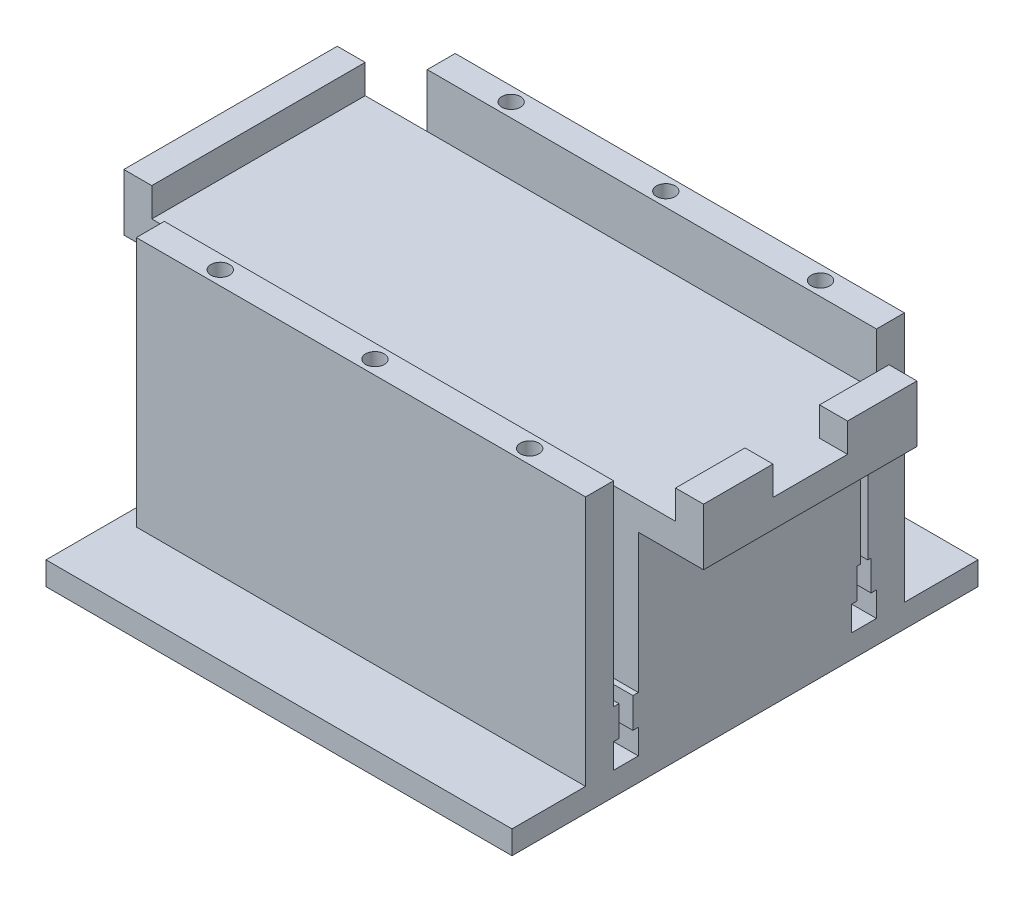
from build123d import *

# Parameters (mm, degrees)
SKETCH1_W            = 46.4
SKETCH1_H            = 24.75
BOSS_EXTRUDE1_DEPTH  = 5.9
BOSS_EXTRUDE2_DEPTH  = 2.5
SKETCH3_W            = 50
SKETCH3_H            = 50
BOSS_EXTRUDE3_DEPTH  = 2.5
SKETCH4_W            = 46.4
SKETCH4_H            = 0.93
BOSS_EXTRUDE4_DEPTH  = 5.9
SKETCH5_W            = 46.4
SKETCH5_H            = 0.93
BOSS_EXTRUDE5_DEPTH  = 5.9
SKETCH6_W            = 46.4
SKETCH6_H            = 3
BOSS_EXTRUDE6_DEPTH  = 8.4
SKETCH7_W            = 46.4
SKETCH7_H            = 3
BOSS_EXTRUDE7_DEPTH  = 8.4
SKETCH8_W            = 46.4
SKETCH8_H            = 22.9
BOSS_EXTRUDE8_DEPTH  = 8.4
SKETCH9_W            = 46.4
SKETCH9_H            = 3
BOSS_EXTRUDE9_DEPTH  = 8.4
SKETCH10_W           = 22.9
SKETCH10_H           = 10.9
BOSS_EXTRUDE10_DEPTH = 1.8
SKETCH11_W           = 0.93
SKETCH11_H           = 5.9
BOSS_EXTRUDE11_DEPTH = 1.8
SKETCH12_W           = 32.7
SKETCH12_H           = 0.925
SKETCH12_H_2         = 0.93
BOSS_EXTRUDE12_DEPTH = 8.4
SKETCH13_W           = 0.93
SKETCH13_H           = 5.9
BOSS_EXTRUDE13_DEPTH = 1.8
SKETCH14_W           = 48.2
SKETCH14_H           = 3
BOSS_EXTRUDE14_DEPTH = 8.4
SKETCH15_W           = 32.7
SKETCH15_H           = 0.93
SKETCH15_H_2         = 0.925
BOSS_EXTRUDE15_DEPTH = 8.4
SKETCH16_W           = 0.35
SKETCH16_H           = 5.9
CUT_EXTRUDE1_DEPTH   = 59.371568422
SKETCH18_W           = 0.35
SKETCH18_H           = 5.9
CUT_EXTRUDE2_DEPTH   = 59.371568422
SKETCH20_W           = 22.9
SKETCH20_H           = 2.5
BOSS_EXTRUDE17_DEPTH = 4
SKETCH22_W           = 22.9
SKETCH22_H           = 2.5
BOSS_EXTRUDE19_DEPTH = 3
SKETCH23_W           = 3
SKETCH23_H           = 22.9
BOSS_EXTRUDE20_DEPTH = 1.5
SKETCH24_W           = 22.9
SKETCH24_H           = 2.5
BOSS_EXTRUDE21_DEPTH = 7
SKETCH25_W           = 3
SKETCH25_H           = 22.9
BOSS_EXTRUDE22_DEPTH = 3
SKETCH27_W           = 48.2
SKETCH27_H           = 3
BOSS_EXTRUDE23_DEPTH = 7
SKETCH28_W           = 56.2
SKETCH28_H           = 22.9
BOSS_EXTRUDE24_DEPTH = 7
SKETCH29_W           = 3
SKETCH29_H           = 22.9
BOSS_EXTRUDE25_DEPTH = 7
SKETCH30_W           = 3
SKETCH30_H           = 22.9
BOSS_EXTRUDE26_DEPTH = 7
SKETCH31_W           = 7
SKETCH31_H           = 6.5
CUT_EXTRUDE3_DEPTH   = 56.415182938
SKETCH32_W           = 7
SKETCH32_H           = 6.5
CUT_EXTRUDE4_DEPTH   = 56.415182938
SKETCH33_W           = 2.66
SKETCH33_H           = 2.66
CUT_EXTRUDE5_DEPTH   = 67.259188042
SKETCH34_W           = 2.66
SKETCH34_H           = 2.66
CUT_EXTRUDE6_DEPTH   = 67.259188042
SKETCH35_W           = 3
SKETCH35_H           = 8
CUT_EXTRUDE7_DEPTH   = 3
SKETCH36_W           = 3
SKETCH36_H           = 22.9
BOSS_EXTRUDE27_DEPTH = 1.5
SKETCH38_W           = 48.2
SKETCH38_H           = 3
BOSS_EXTRUDE28_DEPTH = 3.1
SKETCH39_W           = 48.2
SKETCH39_H           = 3
BOSS_EXTRUDE29_DEPTH = 3.1
SKETCH40_W           = 3
SKETCH40_H           = 7.45
BOSS_EXTRUDE30_DEPTH = 0.1
SKETCH41_W           = 3
SKETCH41_H           = 22.9
BOSS_EXTRUDE31_DEPTH = 0.1
SKETCH42_R           = 1
CUT_EXTRUDE8_DEPTH   = 10


with BuildPart() as part:
    # Sketch1 → Boss-Extrude1 (new body)
    with BuildSketch(Plane(origin=(0, 0, 0), x_dir=(1, 0, 0), z_dir=(0, 1, 0))):
        Rectangle(SKETCH1_W, SKETCH1_H)
    extrude(amount=BOSS_EXTRUDE1_DEPTH)

    # Sketch2 → Boss-Extrude2 (add)
    with BuildSketch(Plane(origin=(0, 5.9, 0), x_dir=(1, 0, 0), z_dir=(0, 1, 0))):
        Polygon((23.2, -11.45), (23.2, 0), (23.2, 11.45), (-23.2, 11.45), (-23.2, -11.45), align=None)
    extrude(amount=BOSS_EXTRUDE2_DEPTH)

    # Sketch3 → Boss-Extrude3 (add)
    with BuildSketch(Plane.XZ):
        Rectangle(SKETCH3_W, SKETCH3_H)
    extrude(amount=BOSS_EXTRUDE3_DEPTH)

    # Sketch4 → Boss-Extrude4 (add)
    with BuildSketch(Plane(origin=(0, 0, 0), x_dir=(1, 0, 0), z_dir=(0, 1, 0))):
        with Locations((0, 13.64)):
            Rectangle(SKETCH4_W, SKETCH4_H)
    extrude(amount=BOSS_EXTRUDE4_DEPTH)

    # Sketch5 → Boss-Extrude5 (add)
    with BuildSketch(Plane(origin=(0, 0, 0), x_dir=(1, 0, 0), z_dir=(0, 1, 0))):
        with Locations((0, -13.64)):
            Rectangle(SKETCH5_W, SKETCH5_H)
    extrude(amount=BOSS_EXTRUDE5_DEPTH)

    # Sketch6 → Boss-Extrude6 (add)
    with BuildSketch(Plane(origin=(0, 0, 0), x_dir=(1, 0, 0), z_dir=(0, 1, 0))):
        with Locations((0, 15.605)):
            Rectangle(SKETCH6_W, SKETCH6_H)
    extrude(amount=BOSS_EXTRUDE6_DEPTH)

    # Sketch7 → Boss-Extrude7 (add)
    with BuildSketch(Plane(origin=(0, 0, 0), x_dir=(1, 0, 0), z_dir=(0, 1, 0))):
        with Locations((0, -15.605)):
            Rectangle(SKETCH7_W, SKETCH7_H)
    extrude(amount=BOSS_EXTRUDE7_DEPTH)

    # Sketch8 → Boss-Extrude8 (add)
    with BuildSketch(Plane(origin=(0, 8.4, 0), x_dir=(1, 0, 0), z_dir=(0, 1, 0))):
        Rectangle(SKETCH8_W, SKETCH8_H)
    extrude(amount=BOSS_EXTRUDE8_DEPTH)

    # Sketch9 → Boss-Extrude9 (add)
    with BuildSketch(Plane(origin=(0, 8.4, 0), x_dir=(1, 0, 0), z_dir=(0, 1, 0))):
        with Locations((0, -15.605)):
            Rectangle(SKETCH9_W, SKETCH9_H)
    extrude(amount=BOSS_EXTRUDE9_DEPTH)

    # Sketch10 → Boss-Extrude10 (add)
    with BuildSketch(Plane(origin=(23.2, 0, 0), x_dir=(0, 0, -1), z_dir=(1, 0, 0))):
        with Locations((0, 11.35)):
            Rectangle(SKETCH10_W, SKETCH10_H)
        Polygon((-11.45, 5.9), (11.45, 5.9), (12.375, 5.9), (12.375, 0), (-12.375, 0), (-12.375, 5.9), align=None)
    extrude(amount=BOSS_EXTRUDE10_DEPTH)

    # Sketch11 → Boss-Extrude11 (add)
    with BuildSketch(Plane(origin=(23.2, 0, 0), x_dir=(0, 0, -1), z_dir=(1, 0, 0))):
        Polygon((-14.105, 16.8), (-17.105, 16.8), (-17.105, 0), (-14.105, 0), (-14.105, 5.9), align=None)
        with Locations((-13.64, 2.95)):
            Rectangle(SKETCH11_W, SKETCH11_H)
    extrude(amount=BOSS_EXTRUDE11_DEPTH)

    # Sketch12 → Boss-Extrude12 (add)
    with BuildSketch(Plane(origin=(0, 5.9, 0), x_dir=(1, 0, 0), z_dir=(0, 1, 0))):
        with Locations((-6.85, -11.9125)):
            Rectangle(SKETCH12_W, SKETCH12_H)
        with Locations((-6.85, -13.64)):
            Rectangle(SKETCH12_W, SKETCH12_H_2)
    extrude(amount=BOSS_EXTRUDE12_DEPTH)

    # Sketch13 → Boss-Extrude13 (add)
    with BuildSketch(Plane(origin=(23.2, 0, 0), x_dir=(0, 0, -1), z_dir=(1, 0, 0))):
        Polygon((17.105, 0), (17.105, 8.4), (14.105, 8.4), (14.105, 5.9), (14.105, 0), align=None)
        with Locations((13.64, 2.95)):
            Rectangle(SKETCH13_W, SKETCH13_H)
    extrude(amount=BOSS_EXTRUDE13_DEPTH)

    # Sketch14 → Boss-Extrude14 (add)
    with BuildSketch(Plane(origin=(0, 8.4, 0), x_dir=(1, 0, 0), z_dir=(0, 1, 0))):
        with Locations((0.9, 15.605)):
            Rectangle(SKETCH14_W, SKETCH14_H)
    extrude(amount=BOSS_EXTRUDE14_DEPTH)

    # Sketch15 → Boss-Extrude15 (add)
    with BuildSketch(Plane(origin=(0, 5.9, 0), x_dir=(1, 0, 0), z_dir=(0, 1, 0))):
        with Locations((8.65, 13.64)):
            Rectangle(SKETCH15_W, SKETCH15_H)
        with Locations((8.65, 11.9125)):
            Rectangle(SKETCH15_W, SKETCH15_H_2)
    extrude(amount=BOSS_EXTRUDE15_DEPTH)

    # Sketch16 → Cut-Extrude1 (cut, through all)
    with BuildSketch(Plane(origin=(25, 0, 0), x_dir=(0, 0, -1), z_dir=(1, 0, 0))):
        with Locations((-12.2, 2.95)):
            Rectangle(SKETCH16_W, SKETCH16_H)
        with Locations((-13.35, 2.95)):
            Rectangle(SKETCH16_W, SKETCH16_H)
    extrude(amount=-CUT_EXTRUDE1_DEPTH, mode=Mode.SUBTRACT)

    # Sketch18 → Cut-Extrude2 (cut, through all)
    with BuildSketch(Plane(origin=(25, 0, 0), x_dir=(0, 0, -1), z_dir=(1, 0, 0))):
        with Locations((12.2, 2.95)):
            Rectangle(SKETCH18_W, SKETCH18_H)
        with Locations((13.35, 2.95)):
            Rectangle(SKETCH18_W, SKETCH18_H)
    extrude(amount=-CUT_EXTRUDE2_DEPTH, mode=Mode.SUBTRACT)

    # Sketch20 → Boss-Extrude17 (add)
    with BuildSketch(Plane.ZY.offset(23.2)):
        with Locations((0, 15.55)):
            Rectangle(SKETCH20_W, SKETCH20_H)
    extrude(amount=BOSS_EXTRUDE17_DEPTH)

    # Sketch22 → Boss-Extrude19 (add)
    with BuildSketch(Plane.ZY.offset(27.2)):
        with Locations((0, 15.55)):
            Rectangle(SKETCH22_W, SKETCH22_H)
    extrude(amount=BOSS_EXTRUDE19_DEPTH)

    # Sketch23 → Boss-Extrude20 (add)
    with BuildSketch(Plane(origin=(0, 16.8, 0), x_dir=(1, 0, 0), z_dir=(0, 1, 0))):
        with Locations((-28.7, 0)):
            Rectangle(SKETCH23_W, SKETCH23_H)
    extrude(amount=BOSS_EXTRUDE20_DEPTH)

    # Sketch24 → Boss-Extrude21 (add)
    with BuildSketch(Plane(origin=(25, 0, 0), x_dir=(0, 0, -1), z_dir=(1, 0, 0))):
        with Locations((0, 15.55)):
            Rectangle(SKETCH24_W, SKETCH24_H)
    extrude(amount=BOSS_EXTRUDE21_DEPTH)

    # Sketch25 → Boss-Extrude22 (add)
    with BuildSketch(Plane(origin=(0, 16.8, 0), x_dir=(1, 0, 0), z_dir=(0, 1, 0))):
        with Locations((30.5, 0)):
            Rectangle(SKETCH25_W, SKETCH25_H)
    extrude(amount=BOSS_EXTRUDE22_DEPTH)

    # Sketch27 → Boss-Extrude23 (add)
    with BuildSketch(Plane(origin=(0, 16.8, 0), x_dir=(1, 0, 0), z_dir=(0, 1, 0))):
        with Locations((0.9, 15.605)):
            Rectangle(SKETCH27_W, SKETCH27_H)
        with Locations((0.9, -15.605)):
            Rectangle(SKETCH27_W, SKETCH27_H)
    extrude(amount=BOSS_EXTRUDE23_DEPTH)

    # Sketch28 → Boss-Extrude24 (add)
    with BuildSketch(Plane(origin=(0, 16.8, 0), x_dir=(1, 0, 0), z_dir=(0, 1, 0))):
        with Locations((0.9, 0)):
            Rectangle(SKETCH28_W, SKETCH28_H)
    extrude(amount=BOSS_EXTRUDE24_DEPTH)

    # Sketch29 → Boss-Extrude25 (add)
    with BuildSketch(Plane(origin=(0, 18.3, 0), x_dir=(1, 0, 0), z_dir=(0, 1, 0))):
        with Locations((-28.7, 0)):
            Rectangle(SKETCH29_W, SKETCH29_H)
    extrude(amount=BOSS_EXTRUDE25_DEPTH)

    # Sketch30 → Boss-Extrude26 (add)
    with BuildSketch(Plane(origin=(0, 19.8, 0), x_dir=(1, 0, 0), z_dir=(0, 1, 0))):
        with Locations((30.5, 0)):
            Rectangle(SKETCH30_W, SKETCH30_H)
    extrude(amount=BOSS_EXTRUDE26_DEPTH)

    # Sketch31 → Cut-Extrude3 (cut, through all)
    with BuildSketch(Plane(origin=(0, 0, -11.45), x_dir=(-1, 0, 0), z_dir=(0, 0, -1))):
        with Locations((26.7, 17.55)):
            Rectangle(SKETCH31_W, SKETCH31_H)
    extrude(amount=-CUT_EXTRUDE3_DEPTH, mode=Mode.SUBTRACT)

    # Sketch32 → Cut-Extrude4 (cut, through all)
    with BuildSketch(Plane.XY.offset(11.45)):
        with Locations((28.5, 17.55)):
            Rectangle(SKETCH32_W, SKETCH32_H)
    extrude(amount=-CUT_EXTRUDE4_DEPTH, mode=Mode.SUBTRACT)

    # Sketch33 → Cut-Extrude5 (cut, through all)
    with BuildSketch(Plane.ZY.offset(23.2)):
        with Locations((-12.775, 1.33)):
            Rectangle(SKETCH33_W, SKETCH33_H)
    extrude(amount=-CUT_EXTRUDE5_DEPTH, mode=Mode.SUBTRACT)

    # Sketch34 → Cut-Extrude6 (cut, through all)
    with BuildSketch(Plane.ZY.offset(23.2)):
        with Locations((12.775, 1.33)):
            Rectangle(SKETCH34_W, SKETCH34_H)
    extrude(amount=-CUT_EXTRUDE6_DEPTH, mode=Mode.SUBTRACT)

    # Sketch35 → Cut-Extrude7 (cut)
    with BuildSketch(Plane(origin=(0, 26.8, 0), x_dir=(1, 0, 0), z_dir=(0, 1, 0))):
        with Locations((30.5, 0)):
            Rectangle(SKETCH35_W, SKETCH35_H)
    extrude(amount=-CUT_EXTRUDE7_DEPTH, mode=Mode.SUBTRACT)

    # Sketch36 → Boss-Extrude27 (add)
    with BuildSketch(Plane(origin=(0, 25.3, 0), x_dir=(1, 0, 0), z_dir=(0, 1, 0))):
        with Locations((-28.7, 0)):
            Rectangle(SKETCH36_W, SKETCH36_H)
    extrude(amount=BOSS_EXTRUDE27_DEPTH)

    # Sketch38 → Boss-Extrude28 (add)
    with BuildSketch(Plane(origin=(0, 23.8, 0), x_dir=(1, 0, 0), z_dir=(0, 1, 0))):
        with Locations((0.9, -15.605)):
            Rectangle(SKETCH38_W, SKETCH38_H)
    extrude(amount=BOSS_EXTRUDE28_DEPTH)

    # Sketch39 → Boss-Extrude29 (add)
    with BuildSketch(Plane(origin=(0, 23.8, 0), x_dir=(1, 0, 0), z_dir=(0, 1, 0))):
        with Locations((0.9, 15.605)):
            Rectangle(SKETCH39_W, SKETCH39_H)
    extrude(amount=BOSS_EXTRUDE29_DEPTH)

    # Sketch40 → Boss-Extrude30 (add)
    with BuildSketch(Plane(origin=(0, 26.8, 0), x_dir=(1, 0, 0), z_dir=(0, 1, 0))):
        with Locations((30.5, 7.725)):
            Rectangle(SKETCH40_W, SKETCH40_H)
        with Locations((30.5, -7.725)):
            Rectangle(SKETCH40_W, SKETCH40_H)
    extrude(amount=BOSS_EXTRUDE30_DEPTH)

    # Sketch41 → Boss-Extrude31 (add)
    with BuildSketch(Plane(origin=(0, 26.8, 0), x_dir=(1, 0, 0), z_dir=(0, 1, 0))):
        with Locations((-28.7, 0)):
            Rectangle(SKETCH41_W, SKETCH41_H)
    extrude(amount=BOSS_EXTRUDE31_DEPTH)

    # Sketch42 → Cut-Extrude8 (cut)
    with BuildSketch(Plane(origin=(0, 26.9, 0), x_dir=(1, 0, 0), z_dir=(0, 1, 0))):
        with Locations(Location((-15.7, -15.605, 0), (0, 0, 270))):
            Circle(SKETCH42_R)
        with Locations(Location((-15.7, 15.605, 0), (0, 0, 270))):
            Circle(SKETCH42_R)
        with Locations(Location((17.5, -15.605, 0), (0, 0, 270))):
            Circle(SKETCH42_R)
        with Locations(Location((17.5, 15.605, 0), (0, 0, 270))):
            Circle(SKETCH42_R)
        with Locations(Location((0.9, -15.605, 0), (0, 0, 270))):
            Circle(SKETCH42_R)
        with Locations(Location((0.9, 15.605, 0), (0, 0, 270))):
            Circle(SKETCH42_R)
    extrude(amount=-CUT_EXTRUDE8_DEPTH, mode=Mode.SUBTRACT)


solid = part.part
